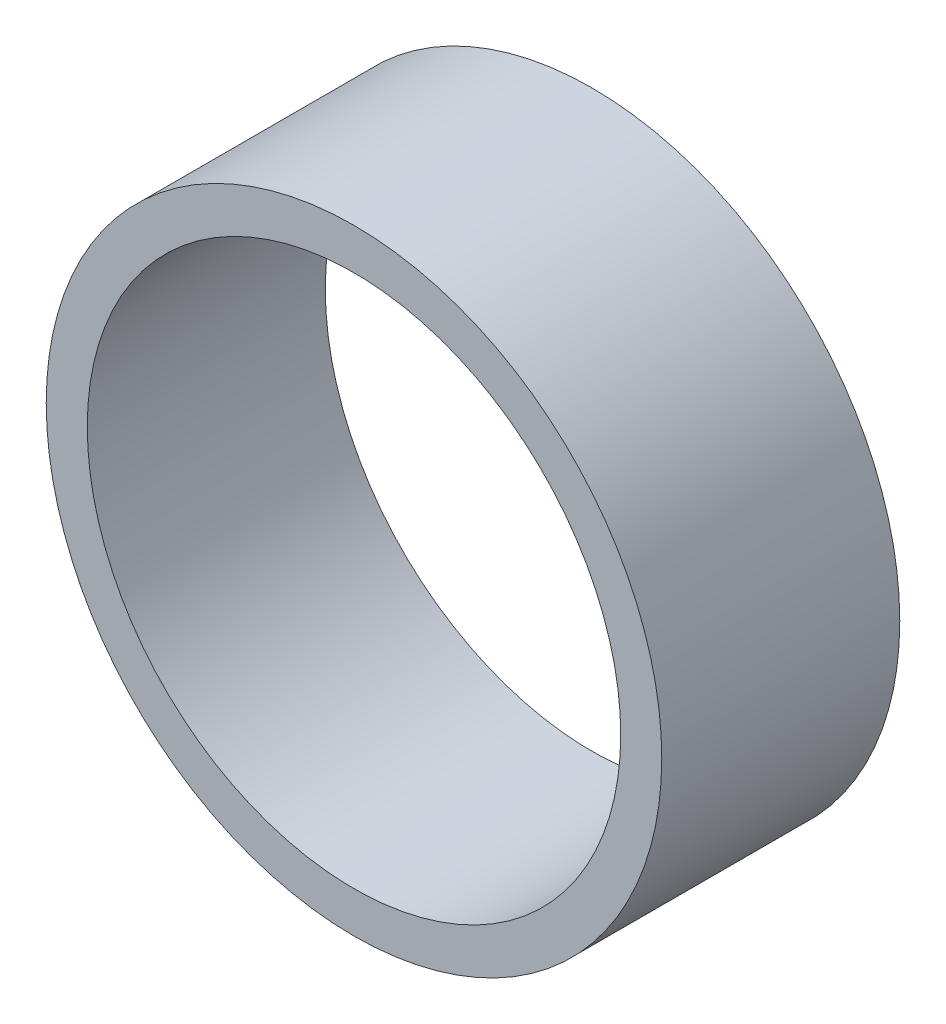
from build123d import *

# Parameters (mm, degrees)
SKETCH1_R           = 7.5
BOSS_EXTRUDE1_DEPTH = 5.8
SKETCH2_R           = 6.5
CUT_EXTRUDE1_DEPTH  = 5.8


with BuildPart() as part:
    # Sketch1 → Boss-Extrude1 (new body)
    with BuildSketch(Plane.XY):
        with Locations((-43.212664647, 1.441865661)):
            Circle(SKETCH1_R)
    extrude(amount=BOSS_EXTRUDE1_DEPTH)

    # Sketch2 → Cut-Extrude1 (cut)
    with BuildSketch(Plane.XY.offset(5.8)):
        with Locations((-43.212664647, 1.441865661)):
            Circle(SKETCH2_R)
    extrude(amount=-CUT_EXTRUDE1_DEPTH, mode=Mode.SUBTRACT)


solid = part.part
